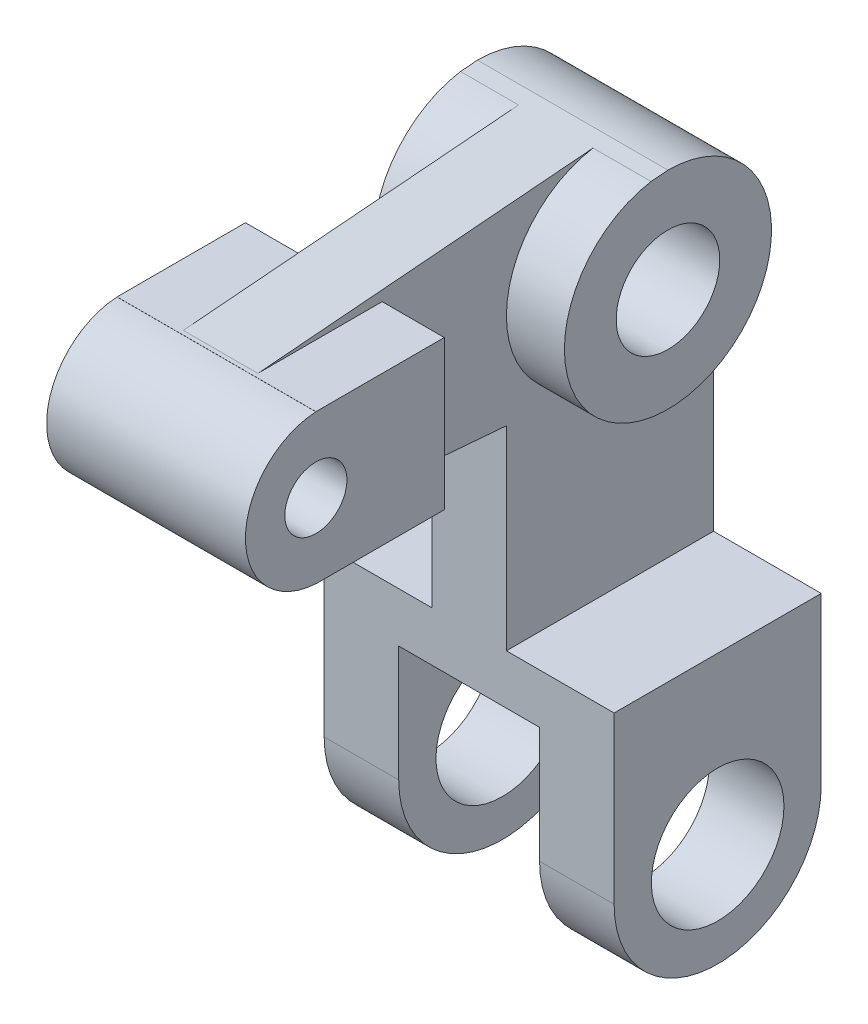
from build123d import *

# Parameters (mm, degrees)
ESBO_O1_R                = 7.5
RESSALTO_EXTRUS_O1_DEPTH = 24
RESSALTO_EXTRUS_O2_DEPTH = 9
ESBO_O1_4_R              = 12.5
RESSALTO_EXTRUS_O3_DEPTH = 23
ESBO_O1_5_R              = 16
RESSALTO_EXTRUS_O4_DEPTH = 35
ESBO_O2_W                = 34
ESBO_O2_H                = 66.30992931
CORTE_EXTRUS_O1_DEPTH    = 70
ESBO_O3_W                = 48
ESBO_O3_H                = 36
RESSALTO_EXTRUS_O7_DEPTH = 31
ESBO_O4_R                = 7.5
CORTE_EXTRUS_O2_DEPTH    = 48.5


with BuildPart() as part:
    # Esboço1 → Ressalto-extrusão1 (new, symmetric)
    with BuildSketch(Plane(origin=(0, 0, 0), x_dir=(0, 0, -1), z_dir=(1, 0, 0))):
        with BuildLine():
            ThreePointArc((-67, 110), (-72.272077939, 122.727922061), (-85, 128))
            ThreePointArc((-85, 128), (-103, 110), (-85, 92))
            ThreePointArc((-85, 92), (-72.272077939, 97.272077939), (-67, 110))
        make_face()
        with Locations((-85, 110)):
            Circle(ESBO_O1_R, mode=Mode.SUBTRACT)
    extrude(amount=RESSALTO_EXTRUS_O1_DEPTH, both=True)

    # Esboço1<3> → Ressalto-extrusão2 (add, symmetric)
    with BuildSketch(Plane(origin=(0, 0, 0), x_dir=(0, 0, -1), z_dir=(1, 0, 0))):
        with BuildLine():
            Line((25, 40), (25, 110))
            ThreePointArc((25, 110), (-16.167131291, 90.931075913), (-4.089909266, 134.663183943))
            Line((-4.089909266, 134.663183943), (-85, 128))
            ThreePointArc((-85, 128), (-72.272077939, 122.727922061), (-67, 110))
            ThreePointArc((-67, 110), (-72.272077939, 97.272077939), (-85, 92))
            Line((-85, 92), (-25, 87.058823529))
            Line((-25, 87.058823529), (-25, 40))
            Line((-25, 40), (25, 40))
        make_face()
    extrude(amount=RESSALTO_EXTRUS_O2_DEPTH, both=True)

    # Esboço1<4> → Ressalto-extrusão3 (add, symmetric)
    with BuildSketch(Plane(origin=(0, 0, 0), x_dir=(0, 0, -1), z_dir=(1, 0, 0))):
        with BuildLine():
            ThreePointArc((-4.089909266, 134.663183943), (-16.167131291, 90.931075913), (25, 110))
            ThreePointArc((25, 110), (17.67766953, 127.67766953), (0, 135))
            Line((0, 135), (-4.089909266, 134.663183943))
        make_face()
        with Locations((0, 110)):
            Circle(ESBO_O1_4_R, mode=Mode.SUBTRACT)
    extrude(amount=RESSALTO_EXTRUS_O3_DEPTH, both=True)

    # Esboço1<5> → Ressalto-extrusão4 (add, symmetric)
    with BuildSketch(Plane(origin=(0, 0, 0), x_dir=(0, 0, -1), z_dir=(1, 0, 0))):
        with BuildLine():
            Line((25, 0), (25, 40))
            Line((25, 40), (-25, 40))
            Line((-25, 40), (-25, 0))
            ThreePointArc((-25, 0), (0, -25), (25, 0))
        make_face()
        Circle(ESBO_O1_5_R, mode=Mode.SUBTRACT)
    extrude(amount=RESSALTO_EXTRUS_O4_DEPTH, both=True)

    # Esboço2 → Corte-extrusão1 (cut, symmetric)
    with BuildSketch(Plane.XY):
        with Locations((0, -5.154964655)):
            Rectangle(ESBO_O2_W, ESBO_O2_H)
    extrude(amount=CORTE_EXTRUS_O1_DEPTH, both=True, mode=Mode.SUBTRACT)

    # Esboço3 → Ressalto-extrusão7 (add)
    with BuildSketch(Plane.XY.offset(55)):
        with Locations((0, 110)):
            Rectangle(ESBO_O3_W, ESBO_O3_H)
    extrude(amount=RESSALTO_EXTRUS_O7_DEPTH)

    # Esboço4 → Corte-extrusão2 (cut, symmetric)
    with BuildSketch(Plane(origin=(0, 0, 0), x_dir=(0, 0, -1), z_dir=(1, 0, 0))):
        with Locations((-86, 110)):
            Circle(ESBO_O4_R)
    extrude(amount=CORTE_EXTRUS_O2_DEPTH, both=True, mode=Mode.SUBTRACT)


solid = part.part
